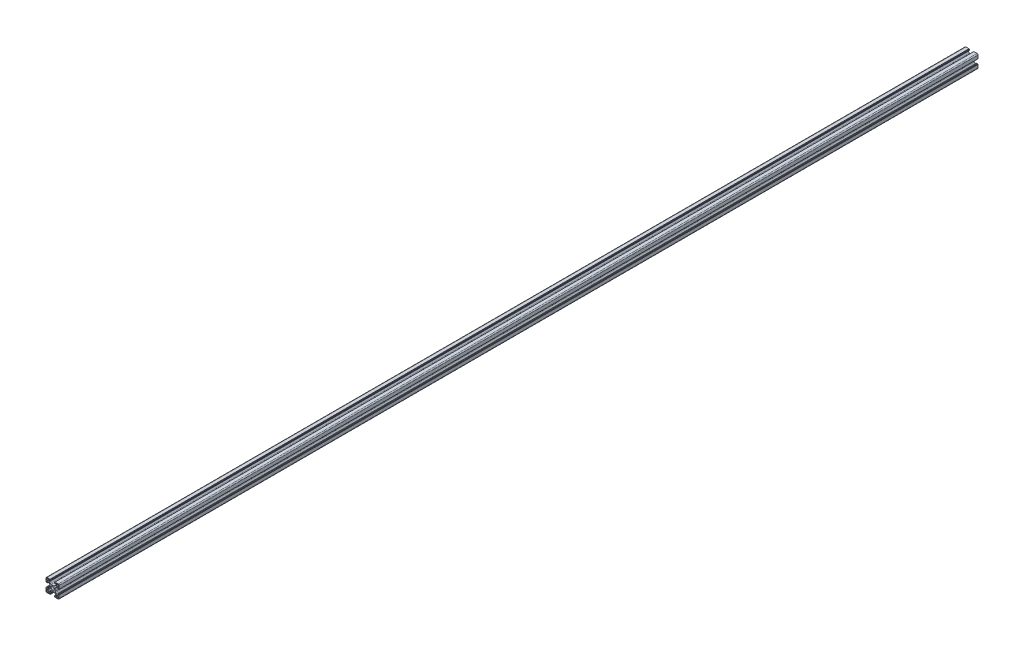
from build123d import *

# Parameters (mm, degrees)
EXTRUDE_1_DEPTH = 1400


with BuildPart() as part:
    # Эскиз1 → Бобышка-Вытянуть1 (new body)
    with BuildSketch(Plane.XY):
        with BuildLine():
            Line((0.259458272, 4.035699369), (2.158238941, 4.035699369))
            ThreePointArc((2.158238941, 4.035699369), (2.923605806, 4.187940304), (3.572452504, 4.621485807))
            Line((3.572452504, 4.621485807), (4.873671834, 5.922705138))
            ThreePointArc((4.873671834, 5.922705138), (5.307217337, 6.571551836), (5.459458272, 7.3369187))
            Line((5.459458272, 7.3369187), (5.459458272, 8.235699369))
            ThreePointArc((5.459458272, 8.235699369), (5.313011663, 8.58925276), (4.959458272, 8.735699369))
            Line((4.959458272, 8.735699369), (4.856565053, 8.735699369))
            ThreePointArc((4.856565053, 8.735699369), (4.665223337, 8.697639136), (4.503011663, 8.58925276))
            Line((4.503011663, 8.58925276), (4.022681577, 8.108922674))
            ThreePointArc((4.022681577, 8.108922674), (3.94157574, 8.054729486), (3.845904882, 8.035699369))
            Line((3.845904882, 8.035699369), (3.559458272, 8.035699369))
            ThreePointArc((3.559458272, 8.035699369), (3.382681577, 8.108922674), (3.309458272, 8.285699369))
            Line((3.309458272, 8.285699369), (3.309458272, 9.43477019))
            ThreePointArc((3.309458272, 9.43477019), (3.353392255, 9.540836207), (3.459458272, 9.58477019))
            Line((3.459458272, 9.58477019), (3.959458272, 9.58477019))
            Line((3.959458272, 9.58477019), (3.959458272, 9.885699369))
            ThreePointArc((3.959458272, 9.885699369), (4.003392255, 9.991765387), (4.109458272, 10.035699369))
            Line((4.109458272, 10.035699369), (8.759458272, 10.035699369))
            ThreePointArc((8.759458272, 10.035699369), (9.820118444, 9.596359541), (10.259458272, 8.535699369))
            Line((10.259458272, 8.535699369), (10.259458272, 3.885699369))
            ThreePointArc((10.259458272, 3.885699369), (10.215524289, 3.779633352), (10.109458272, 3.735699369))
            Line((10.109458272, 3.735699369), (9.808529093, 3.735699369))
            Line((9.808529093, 3.735699369), (9.808529093, 3.235699369))
            ThreePointArc((9.808529093, 3.235699369), (9.76459511, 3.129633352), (9.658529093, 3.085699369))
            Line((9.658529093, 3.085699369), (8.509458272, 3.085699369))
            ThreePointArc((8.509458272, 3.085699369), (8.332681577, 3.158922674), (8.259458272, 3.335699369))
            Line((8.259458272, 3.335699369), (8.259458272, 3.622145979))
            ThreePointArc((8.259458272, 3.622145979), (8.278488389, 3.717816837), (8.332681577, 3.798922674))
            Line((8.332681577, 3.798922674), (8.813011663, 4.27925276))
            ThreePointArc((8.813011663, 4.27925276), (8.921398038, 4.441464434), (8.959458272, 4.632806151))
            Line((8.959458272, 4.632806151), (8.959458272, 4.735699369))
            ThreePointArc((8.959458272, 4.735699369), (8.813011663, 5.08925276), (8.459458272, 5.235699369))
            Line((8.459458272, 5.235699369), (7.560677603, 5.235699369))
            ThreePointArc((7.560677603, 5.235699369), (6.795310738, 5.083458434), (6.146464041, 4.649912932))
            Line((6.146464041, 4.649912932), (4.84524471, 3.348693601))
            ThreePointArc((4.84524471, 3.348693601), (4.411699207, 2.699846903), (4.259458272, 1.934480039))
            Line((4.259458272, 1.934480039), (4.259458272, 0.035699369))
            Line((4.259458272, 0.035699369), (4.259458272, -1.8630813))
            ThreePointArc((4.259458272, -1.8630813), (4.411699207, -2.628448164), (4.84524471, -3.277294862))
            Line((4.84524471, -3.277294862), (6.146464041, -4.578514193))
            ThreePointArc((6.146464041, -4.578514193), (6.795310738, -5.012059696), (7.560677603, -5.164300631))
            Line((7.560677603, -5.164300631), (8.459458272, -5.164300631))
            ThreePointArc((8.459458272, -5.164300631), (8.813011663, -5.017854021), (8.959458272, -4.664300631))
            Line((8.959458272, -4.664300631), (8.959458272, -4.561407412))
            ThreePointArc((8.959458272, -4.561407412), (8.921398038, -4.370065696), (8.813011663, -4.207854021))
            Line((8.813011663, -4.207854021), (8.332681577, -3.727523935))
            ThreePointArc((8.332681577, -3.727523935), (8.278488389, -3.646418098), (8.259458272, -3.55074724))
            Line((8.259458272, -3.55074724), (8.259458272, -3.264300631))
            ThreePointArc((8.259458272, -3.264300631), (8.332681577, -3.087523935), (8.509458272, -3.014300631))
            Line((8.509458272, -3.014300631), (9.658529093, -3.014300631))
            ThreePointArc((9.658529093, -3.014300631), (9.76459511, -3.058234613), (9.808529093, -3.164300631))
            Line((9.808529093, -3.164300631), (9.808529093, -3.664300631))
            Line((9.808529093, -3.664300631), (10.109458272, -3.664300631))
            ThreePointArc((10.109458272, -3.664300631), (10.215524289, -3.708234613), (10.259458272, -3.814300631))
            Line((10.259458272, -3.814300631), (10.259458272, -8.464300631))
            ThreePointArc((10.259458272, -8.464300631), (9.820118444, -9.524960802), (8.759458272, -9.964300631))
            Line((8.759458272, -9.964300631), (4.109458272, -9.964300631))
            ThreePointArc((4.109458272, -9.964300631), (4.003392255, -9.920366648), (3.959458272, -9.814300631))
            Line((3.959458272, -9.814300631), (3.959458272, -9.513371451))
            Line((3.959458272, -9.513371451), (3.459458272, -9.513371451))
            ThreePointArc((3.459458272, -9.513371451), (3.353392255, -9.469437468), (3.309458272, -9.363371451))
            Line((3.309458272, -9.363371451), (3.309458272, -8.214300631))
            ThreePointArc((3.309458272, -8.214300631), (3.382681577, -8.037523935), (3.559458272, -7.964300631))
            Line((3.559458272, -7.964300631), (3.845904882, -7.964300631))
            ThreePointArc((3.845904882, -7.964300631), (3.94157574, -7.983330747), (4.022681577, -8.037523935))
            Line((4.022681577, -8.037523935), (4.503011663, -8.517854021))
            ThreePointArc((4.503011663, -8.517854021), (4.665223337, -8.626240397), (4.856565053, -8.664300631))
            Line((4.856565053, -8.664300631), (4.959458272, -8.664300631))
            ThreePointArc((4.959458272, -8.664300631), (5.313011663, -8.517854021), (5.459458272, -8.164300631))
            Line((5.459458272, -8.164300631), (5.459458272, -7.265519961))
            ThreePointArc((5.459458272, -7.265519961), (5.307217337, -6.500153097), (4.873671834, -5.851306399))
            Line((4.873671834, -5.851306399), (3.572452504, -4.550087068))
            ThreePointArc((3.572452504, -4.550087068), (2.923605806, -4.116541566), (2.158238941, -3.964300631))
            Line((2.158238941, -3.964300631), (0.259458272, -3.964300631))
            Line((0.259458272, -3.964300631), (-1.639322397, -3.964300631))
            ThreePointArc((-1.639322397, -3.964300631), (-2.404689262, -4.116541566), (-3.053535959, -4.550087068))
            Line((-3.053535959, -4.550087068), (-4.35475529, -5.851306399))
            ThreePointArc((-4.35475529, -5.851306399), (-4.788300793, -6.500153097), (-4.940541728, -7.265519961))
            Line((-4.940541728, -7.265519961), (-4.940541728, -8.164300631))
            ThreePointArc((-4.940541728, -8.164300631), (-4.794095118, -8.517854021), (-4.440541728, -8.664300631))
            Line((-4.440541728, -8.664300631), (-4.337648509, -8.664300631))
            ThreePointArc((-4.337648509, -8.664300631), (-4.146306793, -8.626240397), (-3.984095118, -8.517854021))
            Line((-3.984095118, -8.517854021), (-3.503765033, -8.037523935))
            ThreePointArc((-3.503765033, -8.037523935), (-3.422659195, -7.983330747), (-3.326988337, -7.964300631))
            Line((-3.326988337, -7.964300631), (-3.040541728, -7.964300631))
            ThreePointArc((-3.040541728, -7.964300631), (-2.863765033, -8.037523935), (-2.790541728, -8.214300631))
            Line((-2.790541728, -8.214300631), (-2.790541728, -9.363371451))
            ThreePointArc((-2.790541728, -9.363371451), (-2.834475711, -9.469437468), (-2.940541728, -9.513371451))
            Line((-2.940541728, -9.513371451), (-3.440541728, -9.513371451))
            Line((-3.440541728, -9.513371451), (-3.440541728, -9.814300631))
            ThreePointArc((-3.440541728, -9.814300631), (-3.484475711, -9.920366648), (-3.590541728, -9.964300631))
            Line((-3.590541728, -9.964300631), (-8.240541728, -9.964300631))
            ThreePointArc((-8.240541728, -9.964300631), (-9.3012019, -9.524960802), (-9.740541728, -8.464300631))
            Line((-9.740541728, -8.464300631), (-9.740541728, -3.814300631))
            ThreePointArc((-9.740541728, -3.814300631), (-9.696607745, -3.708234613), (-9.590541728, -3.664300631))
            Line((-9.590541728, -3.664300631), (-9.289612548, -3.664300631))
            Line((-9.289612548, -3.664300631), (-9.289612548, -3.164300631))
            ThreePointArc((-9.289612548, -3.164300631), (-9.245678566, -3.058234613), (-9.139612548, -3.014300631))
            Line((-9.139612548, -3.014300631), (-7.990541728, -3.014300631))
            ThreePointArc((-7.990541728, -3.014300631), (-7.813765033, -3.087523935), (-7.740541728, -3.264300631))
            Line((-7.740541728, -3.264300631), (-7.740541728, -3.55074724))
            ThreePointArc((-7.740541728, -3.55074724), (-7.759571845, -3.646418098), (-7.813765033, -3.727523935))
            Line((-7.813765033, -3.727523935), (-8.294095118, -4.207854021))
            ThreePointArc((-8.294095118, -4.207854021), (-8.402481494, -4.370065696), (-8.440541728, -4.561407412))
            Line((-8.440541728, -4.561407412), (-8.440541728, -4.664300631))
            ThreePointArc((-8.440541728, -4.664300631), (-8.294095118, -5.017854021), (-7.940541728, -5.164300631))
            Line((-7.940541728, -5.164300631), (-7.041761059, -5.164300631))
            ThreePointArc((-7.041761059, -5.164300631), (-6.276394194, -5.012059696), (-5.627547496, -4.578514193))
            Line((-5.627547496, -4.578514193), (-4.326328166, -3.277294862))
            ThreePointArc((-4.326328166, -3.277294862), (-3.892782663, -2.628448164), (-3.740541728, -1.8630813))
            Line((-3.740541728, -1.8630813), (-3.740541728, 0.035699369))
            Line((-3.740541728, 0.035699369), (-3.740541728, 1.934480039))
            ThreePointArc((-3.740541728, 1.934480039), (-3.892782663, 2.699846903), (-4.326328166, 3.348693601))
            Line((-4.326328166, 3.348693601), (-5.627547496, 4.649912932))
            ThreePointArc((-5.627547496, 4.649912932), (-6.276394194, 5.083458434), (-7.041761059, 5.235699369))
            Line((-7.041761059, 5.235699369), (-7.940541728, 5.235699369))
            ThreePointArc((-7.940541728, 5.235699369), (-8.294095118, 5.08925276), (-8.440541728, 4.735699369))
            Line((-8.440541728, 4.735699369), (-8.440541728, 4.632806151))
            ThreePointArc((-8.440541728, 4.632806151), (-8.402481494, 4.441464434), (-8.294095118, 4.27925276))
            Line((-8.294095118, 4.27925276), (-7.813765033, 3.798922674))
            ThreePointArc((-7.813765033, 3.798922674), (-7.759571845, 3.717816837), (-7.740541728, 3.622145979))
            Line((-7.740541728, 3.622145979), (-7.740541728, 3.335699369))
            ThreePointArc((-7.740541728, 3.335699369), (-7.813765033, 3.158922674), (-7.990541728, 3.085699369))
            Line((-7.990541728, 3.085699369), (-9.139612548, 3.085699369))
            ThreePointArc((-9.139612548, 3.085699369), (-9.245678566, 3.129633352), (-9.289612548, 3.235699369))
            Line((-9.289612548, 3.235699369), (-9.289612548, 3.735699369))
            Line((-9.289612548, 3.735699369), (-9.590541728, 3.735699369))
            ThreePointArc((-9.590541728, 3.735699369), (-9.696607745, 3.779633352), (-9.740541728, 3.885699369))
            Line((-9.740541728, 3.885699369), (-9.740541728, 8.535699369))
            ThreePointArc((-9.740541728, 8.535699369), (-9.3012019, 9.596359541), (-8.240541728, 10.035699369))
            Line((-8.240541728, 10.035699369), (-3.590541728, 10.035699369))
            ThreePointArc((-3.590541728, 10.035699369), (-3.484475711, 9.991765387), (-3.440541728, 9.885699369))
            Line((-3.440541728, 9.885699369), (-3.440541728, 9.58477019))
            Line((-3.440541728, 9.58477019), (-2.940541728, 9.58477019))
            ThreePointArc((-2.940541728, 9.58477019), (-2.834475711, 9.540836207), (-2.790541728, 9.43477019))
            Line((-2.790541728, 9.43477019), (-2.790541728, 8.285699369))
            ThreePointArc((-2.790541728, 8.285699369), (-2.863765033, 8.108922674), (-3.040541728, 8.035699369))
            Line((-3.040541728, 8.035699369), (-3.326988337, 8.035699369))
            ThreePointArc((-3.326988337, 8.035699369), (-3.422659195, 8.054729486), (-3.503765033, 8.108922674))
            Line((-3.503765033, 8.108922674), (-3.984095118, 8.58925276))
            ThreePointArc((-3.984095118, 8.58925276), (-4.146306793, 8.697639136), (-4.337648509, 8.735699369))
            Line((-4.337648509, 8.735699369), (-4.440541728, 8.735699369))
            ThreePointArc((-4.440541728, 8.735699369), (-4.794095118, 8.58925276), (-4.940541728, 8.235699369))
            Line((-4.940541728, 8.235699369), (-4.940541728, 7.3369187))
            ThreePointArc((-4.940541728, 7.3369187), (-4.788300793, 6.571551836), (-4.35475529, 5.922705138))
            Line((-4.35475529, 5.922705138), (-3.053535959, 4.621485807))
            ThreePointArc((-3.053535959, 4.621485807), (-2.404689262, 4.187940304), (-1.639322397, 4.035699369))
            Line((-1.639322397, 4.035699369), (0.259458272, 4.035699369))
        make_face()
        with BuildLine():
            Line((7.159458272, 6.135699369), (8.559458272, 6.135699369))
            ThreePointArc((8.559458272, 6.135699369), (9.125143697, 6.370013944), (9.359458272, 6.935699369))
            Line((9.359458272, 6.935699369), (9.359458272, 8.335699369))
            ThreePointArc((9.359458272, 8.335699369), (9.125143697, 8.901384794), (8.559458272, 9.135699369))
            Line((8.559458272, 9.135699369), (7.159458272, 9.135699369))
            ThreePointArc((7.159458272, 9.135699369), (6.593772847, 8.901384794), (6.359458272, 8.335699369))
            Line((6.359458272, 8.335699369), (6.359458272, 6.935699369))
            ThreePointArc((6.359458272, 6.935699369), (6.593772847, 6.370013944), (7.159458272, 6.135699369))
        make_face(mode=Mode.SUBTRACT)
        with BuildLine():
            Line((6.359458272, -6.864300631), (6.359458272, -8.264300631))
            ThreePointArc((6.359458272, -8.264300631), (6.593772847, -8.829986056), (7.159458272, -9.064300631))
            Line((7.159458272, -9.064300631), (8.559458272, -9.064300631))
            ThreePointArc((8.559458272, -9.064300631), (9.125143697, -8.829986056), (9.359458272, -8.264300631))
            Line((9.359458272, -8.264300631), (9.359458272, -6.864300631))
            ThreePointArc((9.359458272, -6.864300631), (9.125143697, -6.298615206), (8.559458272, -6.064300631))
            Line((8.559458272, -6.064300631), (7.159458272, -6.064300631))
            ThreePointArc((7.159458272, -6.064300631), (6.593772847, -6.298615206), (6.359458272, -6.864300631))
        make_face(mode=Mode.SUBTRACT)
        with BuildLine():
            Line((-6.640541728, -6.064300631), (-8.040541728, -6.064300631))
            ThreePointArc((-8.040541728, -6.064300631), (-8.606227153, -6.298615206), (-8.840541728, -6.864300631))
            Line((-8.840541728, -6.864300631), (-8.840541728, -8.264300631))
            ThreePointArc((-8.840541728, -8.264300631), (-8.606227153, -8.829986056), (-8.040541728, -9.064300631))
            Line((-8.040541728, -9.064300631), (-6.640541728, -9.064300631))
            ThreePointArc((-6.640541728, -9.064300631), (-6.074856303, -8.829986056), (-5.840541728, -8.264300631))
            Line((-5.840541728, -8.264300631), (-5.840541728, -6.864300631))
            ThreePointArc((-5.840541728, -6.864300631), (-6.074856303, -6.298615206), (-6.640541728, -6.064300631))
        make_face(mode=Mode.SUBTRACT)
        with BuildLine():
            Line((-5.840541728, 6.935699369), (-5.840541728, 8.335699369))
            ThreePointArc((-5.840541728, 8.335699369), (-6.074856303, 8.901384794), (-6.640541728, 9.135699369))
            Line((-6.640541728, 9.135699369), (-8.040541728, 9.135699369))
            ThreePointArc((-8.040541728, 9.135699369), (-8.606227153, 8.901384794), (-8.840541728, 8.335699369))
            Line((-8.840541728, 8.335699369), (-8.840541728, 6.935699369))
            ThreePointArc((-8.840541728, 6.935699369), (-8.606227153, 6.370013944), (-8.040541728, 6.135699369))
            Line((-8.040541728, 6.135699369), (-6.640541728, 6.135699369))
            ThreePointArc((-6.640541728, 6.135699369), (-6.074856303, 6.370013944), (-5.840541728, 6.935699369))
        make_face(mode=Mode.SUBTRACT)
        with BuildLine():
            ThreePointArc((2.759458272, 0.035699369), (2.027225225, 1.803466322), (0.259458272, 2.535699369))
            ThreePointArc((0.259458272, 2.535699369), (-1.508308681, 1.803466322), (-2.240541728, 0.035699369))
            ThreePointArc((-2.240541728, 0.035699369), (-1.508308681, -1.732067584), (0.259458272, -2.464300631))
            ThreePointArc((0.259458272, -2.464300631), (2.027225225, -1.732067584), (2.759458272, 0.035699369))
        make_face(mode=Mode.SUBTRACT)
    extrude(amount=EXTRUDE_1_DEPTH)


solid = part.part
